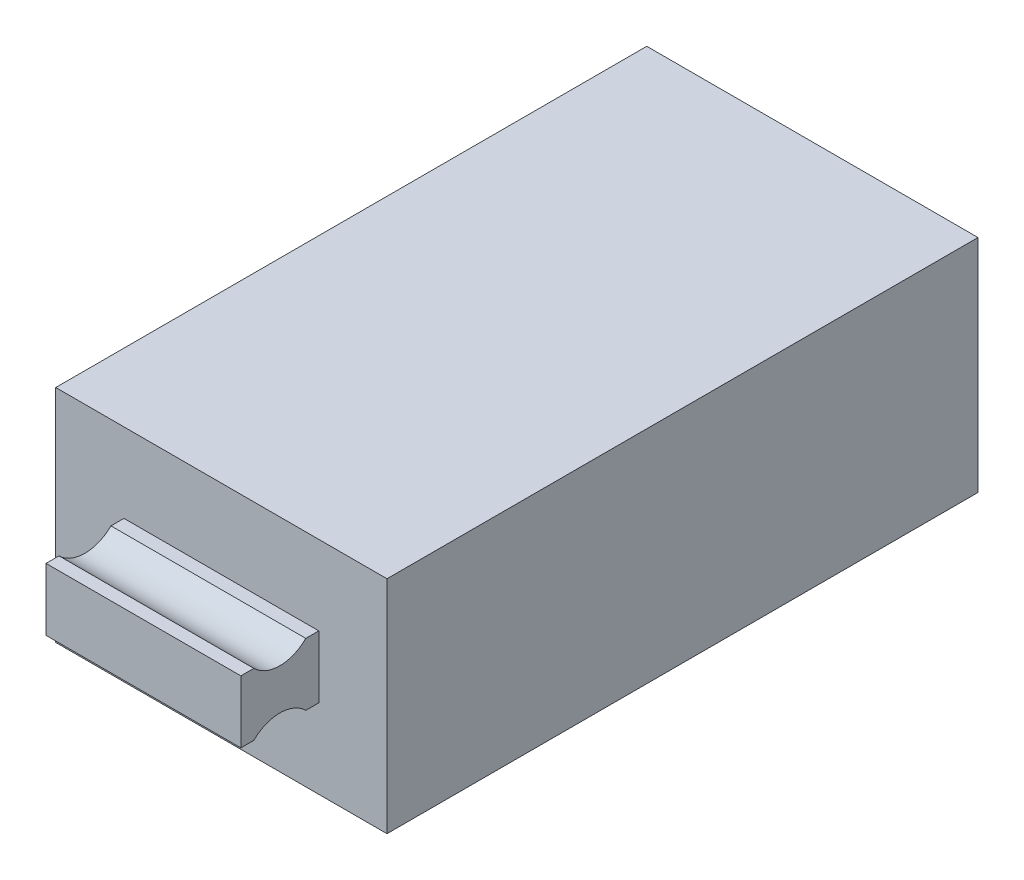
from build123d import *

# Parameters (mm, degrees)
SKETCH1_W           = 51
SKETCH1_H           = 34
BOSS_EXTRUDE1_DEPTH = 91
SKETCH2_W           = 30
SKETCH2_H           = 6
BOSS_EXTRUDE2_DEPTH = 12
BOSS_EXTRUDE3_DEPTH = 30


with BuildPart() as part:
    # Sketch1 → Boss-Extrude1 (new body)
    with BuildSketch(Plane.XY):
        with Locations((25.5, -17)):
            Rectangle(SKETCH1_W, SKETCH1_H)
    extrude(amount=BOSS_EXTRUDE1_DEPTH)

    # Sketch2 → Boss-Extrude2 (add)
    with BuildSketch(Plane.XY.offset(91)):
        with Locations((25.5, -17)):
            Rectangle(SKETCH2_W, SKETCH2_H)
    extrude(amount=BOSS_EXTRUDE2_DEPTH)

    # Sketch3 → Boss-Extrude3 (add)
    with BuildSketch(Plane.ZY.offset(-10.5)):
        with BuildLine():
            Line((91, -12.2), (93, -12.2))
            ThreePointArc((93, -12.2), (97, -13.856854249), (101, -12.2))
            Line((101, -12.2), (103, -12.2))
            Line((103, -12.2), (103, -14))
            Line((103, -14), (91, -14))
            Line((91, -14), (91, -12.2))
        make_face()
        with BuildLine():
            Line((103, -20), (103, -21.8))
            Line((103, -21.8), (101, -21.8))
            ThreePointArc((101, -21.8), (97, -20.143145751), (93, -21.8))
            Line((93, -21.8), (91, -21.8))
            Line((91, -21.8), (91, -20))
            Line((91, -20), (103, -20))
        make_face()
    extrude(amount=-BOSS_EXTRUDE3_DEPTH)


solid = part.part
